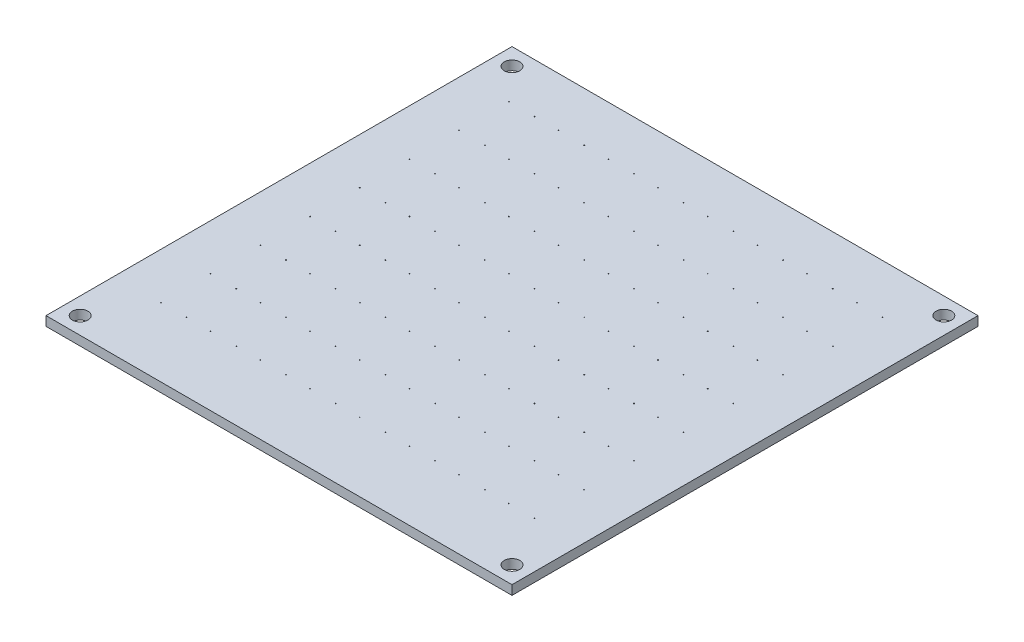
from build123d import *

# Parameters (mm, degrees)
ESBO_O1_W                = 300
ESBO_O1_H                = 300
RESSALTO_EXTRUS_O1_DEPTH = 6
ESBO_O2_R                = 5
CORTE_EXTRUS_O1_DEPTH    = 213.216870206
ESBO_O3_R                = 0.25
CORTE_EXTRUS_O3_DEPTH    = 213.216870206


with BuildPart() as part:
    # Esboço1 → Ressalto-extrusão1 (new body)
    with BuildSketch(Plane(origin=(0, 0, 0), x_dir=(1, 0, 0), z_dir=(0, 1, 0))):
        Rectangle(ESBO_O1_W, ESBO_O1_H)
    extrude(amount=RESSALTO_EXTRUS_O1_DEPTH)

    # Esboço2 → Corte-extrusão1 (cut, through all)
    with BuildSketch(Plane(origin=(0, 6, 0), x_dir=(1, 0, 0), z_dir=(0, 1, 0))):
        with Locations(Location((-139, 139, 0), (0, 0, 270))):
            Circle(ESBO_O2_R)
        with Locations(Location((139, 139, 0), (0, 0, 270))):
            Circle(ESBO_O2_R)
        with Locations(Location((139, -139, 0), (0, 0, 270))):
            Circle(ESBO_O2_R)
        with Locations(Location((-139, -139, 0), (0, 0, 270))):
            Circle(ESBO_O2_R)
    extrude(amount=-CORTE_EXTRUS_O1_DEPTH, mode=Mode.SUBTRACT)

    # Esboço3 → Corte-extrusão3 (cut, through all)
    with BuildSketch(Plane(origin=(0, 6, 0), x_dir=(1, 0, 0), z_dir=(0, 1, 0))):
        with Locations(Location((-103.75, 118.25, 0), (0, 0, 270))):
            Circle(ESBO_O3_R)
        with Locations(Location((-120.25, 118.25, 0), (0, 0, 90))):
            Circle(ESBO_O3_R)
        with Locations(Location((-88.25, 118.25, 0), (0, 0, 90))):
            Circle(ESBO_O3_R)
        with Locations(Location((-71.75, 118.25, 0), (0, 0, 270))):
            Circle(ESBO_O3_R)
        with Locations(Location((-56.25, 118.25, 0), (0, 0, 90))):
            Circle(ESBO_O3_R)
        with Locations(Location((-39.75, 118.25, 0), (0, 0, 270))):
            Circle(ESBO_O3_R)
        with Locations(Location((-24.25, 118.25, 0), (0, 0, 90))):
            Circle(ESBO_O3_R)
        with Locations(Location((-7.75, 118.25, 0), (0, 0, 270))):
            Circle(ESBO_O3_R)
        with Locations(Location((7.75, 118.25, 0), (0, 0, 90))):
            Circle(ESBO_O3_R)
        with Locations(Location((24.25, 118.25, 0), (0, 0, 270))):
            Circle(ESBO_O3_R)
        with Locations(Location((39.75, 118.25, 0), (0, 0, 90))):
            Circle(ESBO_O3_R)
        with Locations(Location((56.25, 118.25, 0), (0, 0, 270))):
            Circle(ESBO_O3_R)
        with Locations(Location((71.75, 118.25, 0), (0, 0, 90))):
            Circle(ESBO_O3_R)
        with Locations(Location((88.25, 118.25, 0), (0, 0, 270))):
            Circle(ESBO_O3_R)
        with Locations(Location((103.75, 118.25, 0), (0, 0, 90))):
            Circle(ESBO_O3_R)
        with Locations(Location((120.25, 118.25, 0), (0, 0, 270))):
            Circle(ESBO_O3_R)
        with Locations(Location((71.75, 86.25, 0), (0, 0, 90))):
            Circle(ESBO_O3_R)
        with Locations(Location((-103.75, 86.25, 0), (0, 0, 270))):
            Circle(ESBO_O3_R)
        with Locations(Location((24.25, 86.25, 0), (0, 0, 270))):
            Circle(ESBO_O3_R)
        with Locations(Location((-7.75, 86.25, 0), (0, 0, 270))):
            Circle(ESBO_O3_R)
        with Locations(Location((103.75, 86.25, 0), (0, 0, 90))):
            Circle(ESBO_O3_R)
        with Locations(Location((-71.75, 86.25, 0), (0, 0, 270))):
            Circle(ESBO_O3_R)
        with Locations(Location((120.25, 86.25, 0), (0, 0, 270))):
            Circle(ESBO_O3_R)
        with Locations(Location((-56.25, 86.25, 0), (0, 0, 90))):
            Circle(ESBO_O3_R)
        with Locations(Location((88.25, 86.25, 0), (0, 0, 270))):
            Circle(ESBO_O3_R)
        with Locations(Location((39.75, 86.25, 0), (0, 0, 90))):
            Circle(ESBO_O3_R)
        with Locations(Location((-120.25, 86.25, 0), (0, 0, 90))):
            Circle(ESBO_O3_R)
        with Locations(Location((-39.75, 86.25, 0), (0, 0, 270))):
            Circle(ESBO_O3_R)
        with Locations(Location((56.25, 86.25, 0), (0, 0, 270))):
            Circle(ESBO_O3_R)
        with Locations(Location((-88.25, 86.25, 0), (0, 0, 90))):
            Circle(ESBO_O3_R)
        with Locations(Location((-24.25, 86.25, 0), (0, 0, 90))):
            Circle(ESBO_O3_R)
        with Locations(Location((7.75, 86.25, 0), (0, 0, 90))):
            Circle(ESBO_O3_R)
        with Locations(Location((71.75, 54.25, 0), (0, 0, 90))):
            Circle(ESBO_O3_R)
        with Locations(Location((-71.75, 54.25, 0), (0, 0, 270))):
            Circle(ESBO_O3_R)
        with Locations(Location((88.25, 54.25, 0), (0, 0, 270))):
            Circle(ESBO_O3_R)
        with Locations(Location((-88.25, 54.25, 0), (0, 0, 90))):
            Circle(ESBO_O3_R)
        with Locations(Location((-24.25, 54.25, 0), (0, 0, 90))):
            Circle(ESBO_O3_R)
        with Locations(Location((103.75, 54.25, 0), (0, 0, 90))):
            Circle(ESBO_O3_R)
        with Locations(Location((39.75, 54.25, 0), (0, 0, 90))):
            Circle(ESBO_O3_R)
        with Locations(Location((56.25, 54.25, 0), (0, 0, 270))):
            Circle(ESBO_O3_R)
        with Locations(Location((7.75, 54.25, 0), (0, 0, 90))):
            Circle(ESBO_O3_R)
        with Locations(Location((-120.25, 54.25, 0), (0, 0, 90))):
            Circle(ESBO_O3_R)
        with Locations(Location((-103.75, 54.25, 0), (0, 0, 270))):
            Circle(ESBO_O3_R)
        with Locations(Location((120.25, 54.25, 0), (0, 0, 270))):
            Circle(ESBO_O3_R)
        with Locations(Location((-56.25, 54.25, 0), (0, 0, 90))):
            Circle(ESBO_O3_R)
        with Locations(Location((-39.75, 54.25, 0), (0, 0, 270))):
            Circle(ESBO_O3_R)
        with Locations(Location((24.25, 54.25, 0), (0, 0, 270))):
            Circle(ESBO_O3_R)
        with Locations(Location((-7.75, 54.25, 0), (0, 0, 270))):
            Circle(ESBO_O3_R)
        with Locations(Location((-120.25, 22.25, 0), (0, 0, 90))):
            Circle(ESBO_O3_R)
        with Locations(Location((-56.25, 22.25, 0), (0, 0, 90))):
            Circle(ESBO_O3_R)
        with Locations(Location((-24.25, 22.25, 0), (0, 0, 90))):
            Circle(ESBO_O3_R)
        with Locations(Location((88.25, 22.25, 0), (0, 0, 270))):
            Circle(ESBO_O3_R)
        with Locations(Location((-103.75, 22.25, 0), (0, 0, 270))):
            Circle(ESBO_O3_R)
        with Locations(Location((-88.25, 22.25, 0), (0, 0, 90))):
            Circle(ESBO_O3_R)
        with Locations(Location((-7.75, 22.25, 0), (0, 0, 270))):
            Circle(ESBO_O3_R)
        with Locations(Location((24.25, 22.25, 0), (0, 0, 270))):
            Circle(ESBO_O3_R)
        with Locations(Location((71.75, 22.25, 0), (0, 0, 90))):
            Circle(ESBO_O3_R)
        with Locations(Location((-71.75, 22.25, 0), (0, 0, 270))):
            Circle(ESBO_O3_R)
        with Locations(Location((-39.75, 22.25, 0), (0, 0, 270))):
            Circle(ESBO_O3_R)
        with Locations(Location((56.25, 22.25, 0), (0, 0, 270))):
            Circle(ESBO_O3_R)
        with Locations(Location((39.75, 22.25, 0), (0, 0, 90))):
            Circle(ESBO_O3_R)
        with Locations(Location((120.25, 22.25, 0), (0, 0, 270))):
            Circle(ESBO_O3_R)
        with Locations(Location((103.75, 22.25, 0), (0, 0, 90))):
            Circle(ESBO_O3_R)
        with Locations(Location((7.75, 22.25, 0), (0, 0, 90))):
            Circle(ESBO_O3_R)
        with Locations(Location((7.75, -9.75, 0), (0, 0, 90))):
            Circle(ESBO_O3_R)
        with Locations(Location((-71.75, -9.75, 0), (0, 0, 270))):
            Circle(ESBO_O3_R)
        with Locations(Location((39.75, -9.75, 0), (0, 0, 90))):
            Circle(ESBO_O3_R)
        with Locations(Location((-88.25, -9.75, 0), (0, 0, 90))):
            Circle(ESBO_O3_R)
        with Locations(Location((24.25, -9.75, 0), (0, 0, 270))):
            Circle(ESBO_O3_R)
        with Locations(Location((-39.75, -9.75, 0), (0, 0, 270))):
            Circle(ESBO_O3_R)
        with Locations(Location((-56.25, -9.75, 0), (0, 0, 90))):
            Circle(ESBO_O3_R)
        with Locations(Location((-103.75, -9.75, 0), (0, 0, 270))):
            Circle(ESBO_O3_R)
        with Locations(Location((-24.25, -9.75, 0), (0, 0, 90))):
            Circle(ESBO_O3_R)
        with Locations(Location((71.75, -9.75, 0), (0, 0, 90))):
            Circle(ESBO_O3_R)
        with Locations(Location((88.25, -9.75, 0), (0, 0, 270))):
            Circle(ESBO_O3_R)
        with Locations(Location((-120.25, -9.75, 0), (0, 0, 90))):
            Circle(ESBO_O3_R)
        with Locations(Location((-7.75, -9.75, 0), (0, 0, 270))):
            Circle(ESBO_O3_R)
        with Locations(Location((56.25, -9.75, 0), (0, 0, 270))):
            Circle(ESBO_O3_R)
        with Locations(Location((103.75, -9.75, 0), (0, 0, 90))):
            Circle(ESBO_O3_R)
        with Locations(Location((120.25, -9.75, 0), (0, 0, 270))):
            Circle(ESBO_O3_R)
        with Locations(Location((-103.75, -41.75, 0), (0, 0, 270))):
            Circle(ESBO_O3_R)
        with Locations(Location((-120.25, -41.75, 0), (0, 0, 90))):
            Circle(ESBO_O3_R)
        with Locations(Location((-56.25, -41.75, 0), (0, 0, 90))):
            Circle(ESBO_O3_R)
        with Locations(Location((71.75, -41.75, 0), (0, 0, 90))):
            Circle(ESBO_O3_R)
        with Locations(Location((120.25, -41.75, 0), (0, 0, 270))):
            Circle(ESBO_O3_R)
        with Locations(Location((103.75, -41.75, 0), (0, 0, 90))):
            Circle(ESBO_O3_R)
        with Locations(Location((88.25, -41.75, 0), (0, 0, 270))):
            Circle(ESBO_O3_R)
        with Locations(Location((-88.25, -41.75, 0), (0, 0, 90))):
            Circle(ESBO_O3_R)
        with Locations(Location((-7.75, -41.75, 0), (0, 0, 270))):
            Circle(ESBO_O3_R)
        with Locations(Location((-71.75, -41.75, 0), (0, 0, 270))):
            Circle(ESBO_O3_R)
        with Locations(Location((24.25, -41.75, 0), (0, 0, 270))):
            Circle(ESBO_O3_R)
        with Locations(Location((39.75, -41.75, 0), (0, 0, 90))):
            Circle(ESBO_O3_R)
        with Locations(Location((-39.75, -41.75, 0), (0, 0, 270))):
            Circle(ESBO_O3_R)
        with Locations(Location((7.75, -41.75, 0), (0, 0, 90))):
            Circle(ESBO_O3_R)
        with Locations(Location((56.25, -41.75, 0), (0, 0, 270))):
            Circle(ESBO_O3_R)
        with Locations(Location((-24.25, -41.75, 0), (0, 0, 90))):
            Circle(ESBO_O3_R)
        with Locations(Location((71.75, -105.75, 0), (0, 0, 90))):
            Circle(ESBO_O3_R)
        with Locations(Location((-71.75, -105.75, 0), (0, 0, 270))):
            Circle(ESBO_O3_R)
        with Locations(Location((-56.25, -73.75, 0), (0, 0, 90))):
            Circle(ESBO_O3_R)
        with Locations(Location((-7.75, -73.75, 0), (0, 0, 270))):
            Circle(ESBO_O3_R)
        with Locations(Location((-7.75, -105.75, 0), (0, 0, 270))):
            Circle(ESBO_O3_R)
        with Locations(Location((39.75, -105.75, 0), (0, 0, 90))):
            Circle(ESBO_O3_R)
        with Locations(Location((-24.25, -73.75, 0), (0, 0, 90))):
            Circle(ESBO_O3_R)
        with Locations(Location((-120.25, -73.75, 0), (0, 0, 90))):
            Circle(ESBO_O3_R)
        with Locations(Location((120.25, -73.75, 0), (0, 0, 270))):
            Circle(ESBO_O3_R)
        with Locations(Location((56.25, -73.75, 0), (0, 0, 270))):
            Circle(ESBO_O3_R)
        with Locations(Location((88.25, -105.75, 0), (0, 0, 270))):
            Circle(ESBO_O3_R)
        with Locations(Location((7.75, -105.75, 0), (0, 0, 90))):
            Circle(ESBO_O3_R)
        with Locations(Location((71.75, -73.75, 0), (0, 0, 90))):
            Circle(ESBO_O3_R)
        with Locations(Location((103.75, -105.75, 0), (0, 0, 90))):
            Circle(ESBO_O3_R)
        with Locations(Location((-39.75, -73.75, 0), (0, 0, 270))):
            Circle(ESBO_O3_R)
        with Locations(Location((-120.25, -105.75, 0), (0, 0, 90))):
            Circle(ESBO_O3_R)
        with Locations(Location((56.25, -105.75, 0), (0, 0, 270))):
            Circle(ESBO_O3_R)
        with Locations(Location((7.75, -73.75, 0), (0, 0, 90))):
            Circle(ESBO_O3_R)
        with Locations(Location((88.25, -73.75, 0), (0, 0, 270))):
            Circle(ESBO_O3_R)
        with Locations(Location((-24.25, -105.75, 0), (0, 0, 90))):
            Circle(ESBO_O3_R)
        with Locations(Location((-71.75, -73.75, 0), (0, 0, 270))):
            Circle(ESBO_O3_R)
        with Locations(Location((120.25, -105.75, 0), (0, 0, 270))):
            Circle(ESBO_O3_R)
        with Locations(Location((39.75, -73.75, 0), (0, 0, 90))):
            Circle(ESBO_O3_R)
        with Locations(Location((-56.25, -105.75, 0), (0, 0, 90))):
            Circle(ESBO_O3_R)
        with Locations(Location((-103.75, -105.75, 0), (0, 0, 270))):
            Circle(ESBO_O3_R)
        with Locations(Location((-103.75, -73.75, 0), (0, 0, 270))):
            Circle(ESBO_O3_R)
        with Locations(Location((-88.25, -105.75, 0), (0, 0, 90))):
            Circle(ESBO_O3_R)
        with Locations(Location((24.25, -105.75, 0), (0, 0, 270))):
            Circle(ESBO_O3_R)
        with Locations(Location((-88.25, -73.75, 0), (0, 0, 90))):
            Circle(ESBO_O3_R)
        with Locations(Location((103.75, -73.75, 0), (0, 0, 90))):
            Circle(ESBO_O3_R)
        with Locations(Location((24.25, -73.75, 0), (0, 0, 270))):
            Circle(ESBO_O3_R)
        with Locations(Location((-39.75, -105.75, 0), (0, 0, 270))):
            Circle(ESBO_O3_R)
    extrude(amount=-CORTE_EXTRUS_O3_DEPTH, mode=Mode.SUBTRACT)


solid = part.part
